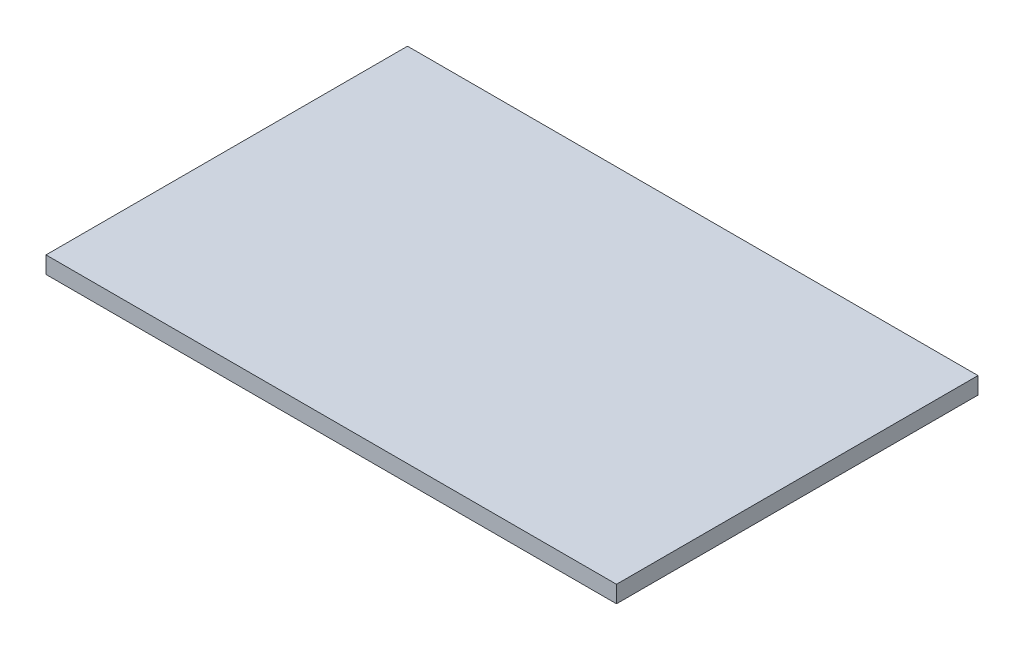
from build123d import *

# Parameters (mm, degrees)
SKETCH1_W           = 101
SKETCH1_H           = 64
BOSS_EXTRUDE1_DEPTH = 3


with BuildPart() as part:
    # Sketch1 → Boss-Extrude1 (new body)
    with BuildSketch(Plane(origin=(0, 0, 0), x_dir=(1, 0, 0), z_dir=(0, 1, 0))):
        Rectangle(SKETCH1_W, SKETCH1_H)
    extrude(amount=BOSS_EXTRUDE1_DEPTH)


solid = part.part
